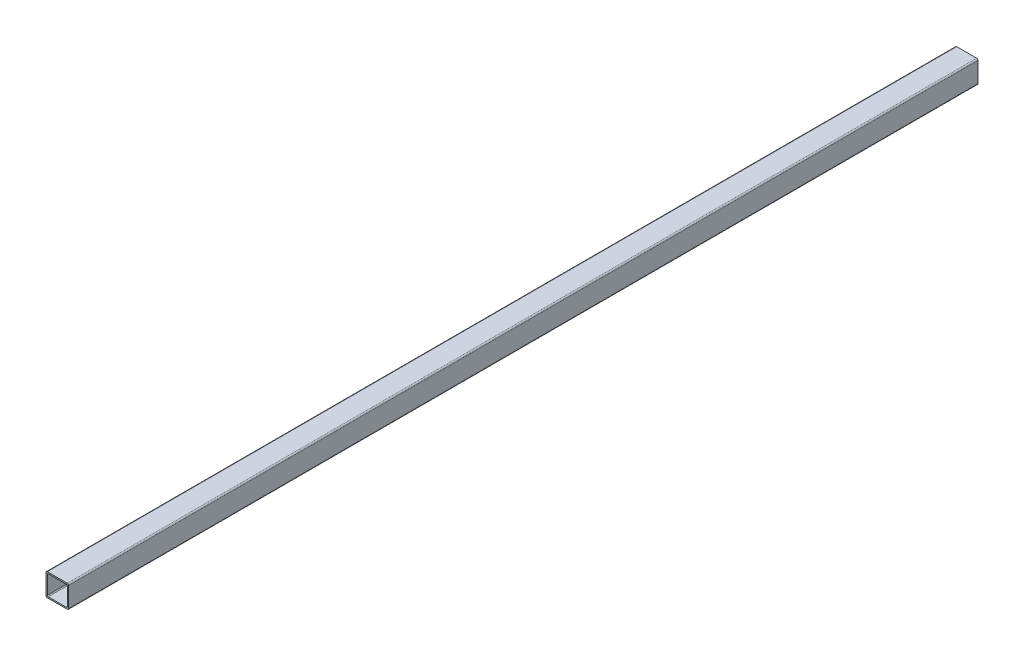
from build123d import *

# Parameters (mm, degrees)
EXTRUDE_1_DEPTH = 4020.282972524


with BuildPart() as part:
    # Эскиз1 → Бобышка-Вытянуть1 (new body)
    with BuildSketch(Plane.XY):
        with BuildLine():
            Line((6, 100), (94, 100))
            ThreePointArc((94, 100), (98.242640687, 98.242640687), (100, 94))
            Line((100, 94), (100, 6))
            ThreePointArc((100, 6), (98.242640687, 1.757359313), (94, 0))
            Line((94, 0), (6, 0))
            ThreePointArc((6, 0), (1.757359313, 1.757359313), (0, 6))
            Line((0, 6), (0, 94))
            ThreePointArc((0, 94), (1.757359313, 98.242640687), (6, 100))
        make_face()
        with BuildLine():
            Line((10, 94), (90, 94))
            ThreePointArc((90, 94), (92.828427125, 92.828427125), (94, 90))
            Line((94, 90), (94, 10))
            ThreePointArc((94, 10), (92.828427125, 7.171572875), (90, 6))
            Line((90, 6), (10, 6))
            ThreePointArc((10, 6), (7.171572875, 7.171572875), (6, 10))
            Line((6, 10), (6, 90))
            ThreePointArc((6, 90), (7.171572875, 92.828427125), (10, 94))
        make_face(mode=Mode.SUBTRACT)
    extrude(amount=EXTRUDE_1_DEPTH)


solid = part.part
